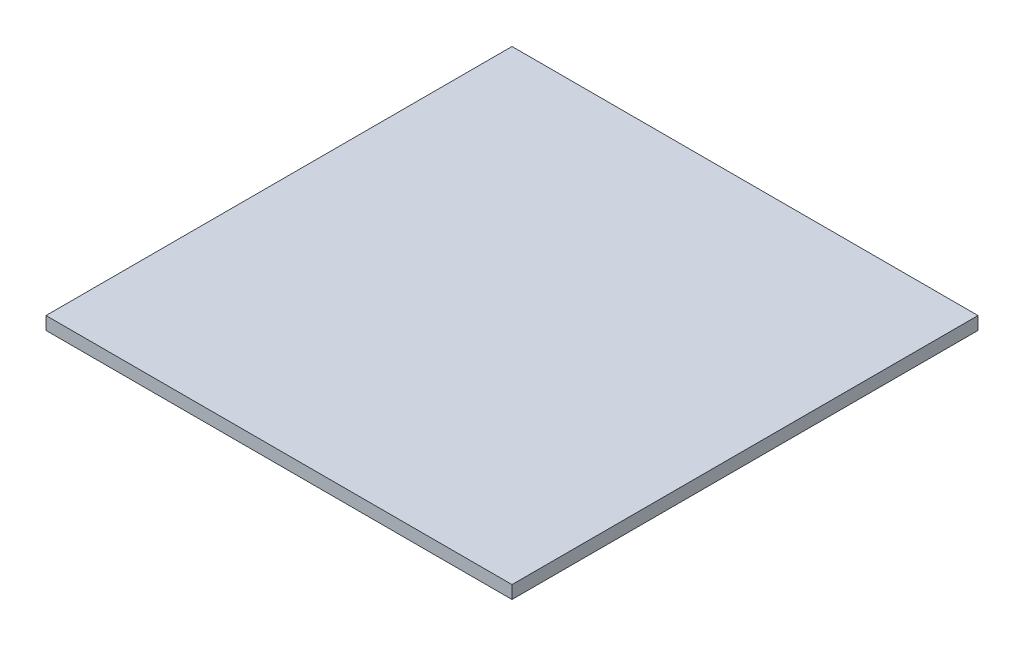
from build123d import *

# Parameters (mm, degrees)
SKETCH_1_W      = 108
SKETCH_1_H      = 108
EXTRUDE_1_DEPTH = 3


with BuildPart() as part:
    # 스케치1 → 보스-돌출1 (new body)
    with BuildSketch(Plane(origin=(0, 0, 0), x_dir=(1, 0, 0), z_dir=(0, 1, 0))):
        Rectangle(SKETCH_1_W, SKETCH_1_H)
    extrude(amount=EXTRUDE_1_DEPTH)


solid = part.part
